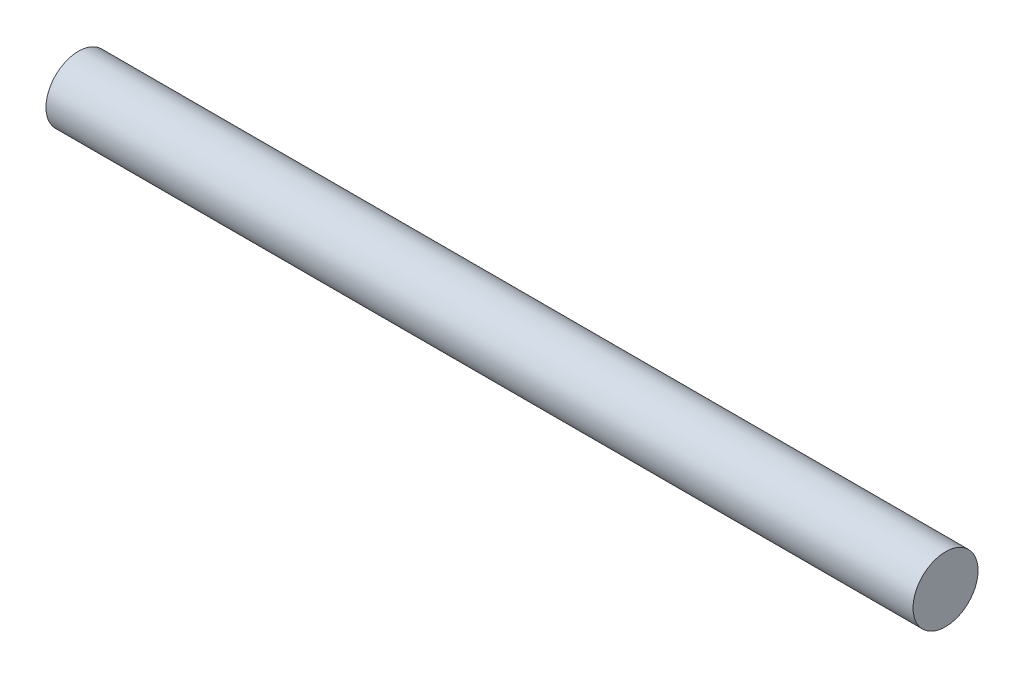
from build123d import *

# Parameters (mm, degrees)
SKETCH_1_W = 40
SKETCH_1_H = 1.5


with BuildPart() as part:
    # Эскиз1 → Повернуть1 (revolve)
    with BuildSketch(Plane.XY, mode=Mode.PRIVATE) as revolve_1_sk:
        with Locations((20, 0.75)):
            Rectangle(SKETCH_1_W, SKETCH_1_H)
    revolve(revolve_1_sk.sketch.rotate(Axis((0, 0, 0), (1, 0, 0)), 90), axis=Axis((0, 0, 0), (1, 0, 0)))


solid = part.part
